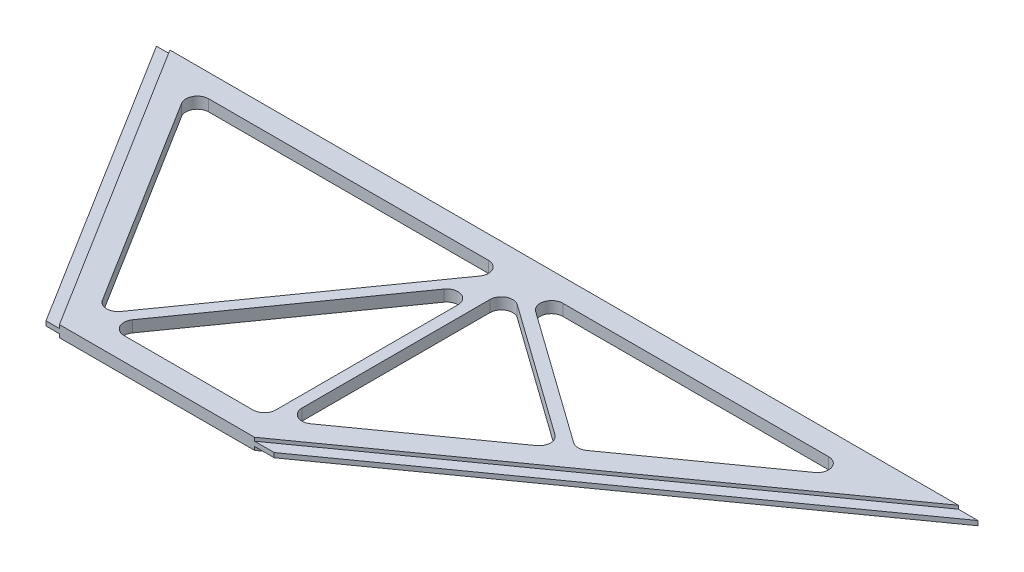
from build123d import *

# Parameters (mm, degrees)
BOSS_EXTRUDE1_DEPTH      = 3.175
BOSS_EXTRUDE1_DEPTH_BACK = 3.175
CUT_EXTRUDE1_DEPTH       = 1.905
CUT_EXTRUDE2_DEPTH       = 6.35
BOSS_EXTRUDE2_DEPTH      = 6.35
FILLET1_R                = 6.35
FILLET2_R                = 6.35


with BuildPart() as part:
    # CS path → Boss-Extrude1 (new, two sides: drawn at the far end of the back side and taken through both)
    with BuildSketch(Plane(origin=(0, 0, 0), x_dir=(1, 0, 0), z_dir=(0, 1, 0)).offset(-BOSS_EXTRUDE1_DEPTH_BACK)):
        Polygon((-228.6, 0), (228.6, 0), (0, -163.068), (-127, -163.068), align=None)
    extrude(amount=BOSS_EXTRUDE1_DEPTH + BOSS_EXTRUDE1_DEPTH_BACK)

    # Sketch1 → Cut-Extrude1 (cut)
    with BuildSketch(Plane(origin=(0, 3.175, 0), x_dir=(1, 0, 0), z_dir=(0, 1, 0))):
        Polygon((-228.6, 0), (-127, -163.068), (-119.518322882, -163.068), (-221.118322882, 0), align=None)
        Polygon((0, -163.068), (228.6, 0), (217.665386403, 0), (-10.934613597, -163.068), align=None)
    cut_extrude1 = extrude(amount=-CUT_EXTRUDE1_DEPTH, mode=Mode.SUBTRACT)

    # Mirror1: Cut-Extrude1 across plane
    add(cut_extrude1.mirror(Plane.ZX), mode=Mode.SUBTRACT)

    # Sketch2 → Cut-Extrude2 (cut)
    with BuildSketch(Plane(origin=(0, 3.175, 0), x_dir=(1, 0, 0), z_dir=(0, 1, 0))):
        Polygon((-198.24219606, -12.7), (177.99242089, -12.7), (-15.000102474, -150.368), (-112.467741232, -150.368), align=None)
    extrude(amount=-CUT_EXTRUDE2_DEPTH, mode=Mode.SUBTRACT)

    # Sketch3 → Boss-Extrude2 (add)
    with BuildSketch(Plane(origin=(0, 3.175, 0), x_dir=(1, 0, 0), z_dir=(0, 1, 0))):
        Polygon((-18.890288084, -12.7), (-114.288712294, -147.445341445), (-112.467741232, -150.368), (-108.577555622, -150.368), (-18.175102474, -22.679209355), (-18.175102474, -150.368), (-15.000102474, -150.368), (-11.825102474, -148.103166667), (-11.825102474, -18.864845516), (78.762505809, -83.484006092), (84.229812607, -79.583993908), (-9.532795675, -12.7), align=None)
    extrude(amount=-BOSS_EXTRUDE2_DEPTH)

    # Fillet1
    fillet1_edges = [part.edges().sort_by_distance(p)[0] for p in [
        (84.229812607, 0, 79.583993908),
        (-114.288712294, 0, 147.445341445),
        (-108.577555622, 0, 150.368),
        (-18.175102474, 0, 150.368),
        (-11.825102474, 0, 148.103166667),
        (78.762505809, 0, 83.484006092),
        (-9.532795675, 0, 12.7),
        (-18.890288084, 0, 12.7),
        (-18.175102474, 0, 22.679209355),
        (-11.825102474, 0, 18.864845516),
    ]]
    fillet(fillet1_edges, radius=FILLET1_R)

    # Fillet2
    fillet2_edges = [part.edges().sort_by_distance(p)[0] for p in [
        (177.99242089, 0, 12.7),
        (-198.24219606, 0, 12.7),
    ]]
    fillet(fillet2_edges, radius=FILLET2_R)


solid = part.part
